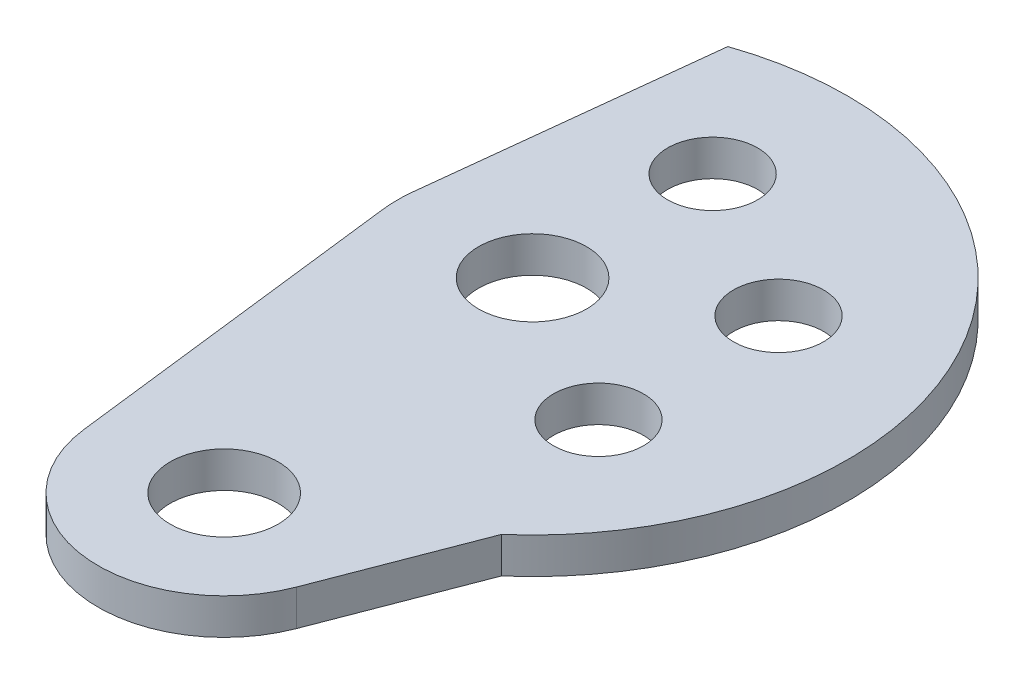
from build123d import *

# Parameters (mm, degrees)
SKETCH_1_R          = 7.5
EXTRUDE_1_DEPTH     = 2
EXTRUDE_START       = -2
SKETCH_2_R          = 3
EXTRUDE_2_DEPTH     = 2
SKETCH_3_R          = 3
CUT_EXTRUDE_1_DEPTH = 2


with BuildPart() as part:
    # 草图1 → 凸台-拉伸1 (new body)
    # profile 1 of 2: a face of its own
    with BuildSketch(Plane(origin=(0, 0, 0), x_dir=(1, 0, 0), z_dir=(0, 1, 0))):
        Circle(SKETCH_1_R)
    # profile 2 of 2: a face of its own
    with BuildSketch(Plane(origin=(0, 0, 0), x_dir=(1, 0, 0), z_dir=(0, 1, 0))):
        with BuildLine():
            ThreePointArc((17.5, 0), (10.160196291, 14.248523128), (-5.702332724, 16.544890495))
            Line((-5.702332724, 16.544890495), (-7.453841227, 0.830813432))
            ThreePointArc((-7.453841227, 0.830813432), (-5.000944874, 5.589324679), (0, 7.5))
            ThreePointArc((0, 7.5), (3.750000007, 6.495190524), (6.495190536, 3.749999986))
            ThreePointArc((6.495190536, 3.749999986), (7.244443699, 1.94114283), (7.5, 0))
            ThreePointArc((7.5, 0), (7.244443692, -1.941142857), (6.495190509, -3.750000034))
            ThreePointArc((6.495190509, -3.750000034), (2.340024706, -7.125607649), (-3.007415076, -6.870622574))
            Line((-3.007415076, -6.870622574), (11.47712911, -13.210810248))
            ThreePointArc((11.47712911, -13.210810248), (15.923249659, -7.25948485), (17.5, 0))
        make_face()
        with BuildLine():
            ThreePointArc((11.160254038, -5), (8.013206444, -7.414814571), (6.495190509, -3.750000034))
            ThreePointArc((6.495190509, -3.750000034), (9.307301631, -2.585185429), (11.160254038, -5))
        make_face(mode=Mode.SUBTRACT)
        with BuildLine():
            ThreePointArc((11.160254038, 5), (9.307301658, 2.585185436), (6.495190536, 3.749999986))
            ThreePointArc((6.495190536, 3.749999986), (8.013206417, 7.414814564), (11.160254038, 5))
        make_face(mode=Mode.SUBTRACT)
        with BuildLine():
            ThreePointArc((2.5, 10), (1.767766953, 8.232233047), (0, 7.5))
            ThreePointArc((0, 7.5), (-1.767766953, 11.767766953), (2.5, 10))
        make_face(mode=Mode.SUBTRACT)
    extrude(amount=EXTRUDE_1_DEPTH)

    # 草图2 → 凸台-拉伸2 (add)
    with BuildSketch(Plane(origin=(0, 2, 0), x_dir=(1, 0, 0), z_dir=(0, 1, 0)).offset(EXTRUDE_START)):
        with BuildLine():
            ThreePointArc((-3.007415076, -6.870622574), (-6.018851538, -4.474754313), (-7.445705299, -0.90081774))
            Line((-7.445705299, -0.90081774), (-5.164424019, -19.756738712))
            ThreePointArc((-5.164424019, -19.756738712), (0.924105936, -25.862847589), (8.318844201, -21.427466138))
            Line((8.318844201, -21.427466138), (11.47712911, -13.210810248))
            Line((11.47712911, -13.210810248), (-3.007415076, -6.870622574))
        make_face()
        with Locations(Location((1.784900926, -18.915975489, 0), (0, 0, 270))):
            Circle(SKETCH_2_R, mode=Mode.SUBTRACT)
    extrude(amount=EXTRUDE_2_DEPTH)

    # 草图3 → 切除-拉伸1 (cut)
    with BuildSketch(Plane(origin=(0, 2, 0), x_dir=(1, 0, 0), z_dir=(0, 1, 0))):
        with Locations(Location((0, 0, 0), (0, 0, 270))):
            Circle(SKETCH_3_R)
    extrude(amount=-CUT_EXTRUDE_1_DEPTH, mode=Mode.SUBTRACT)


solid = part.part
